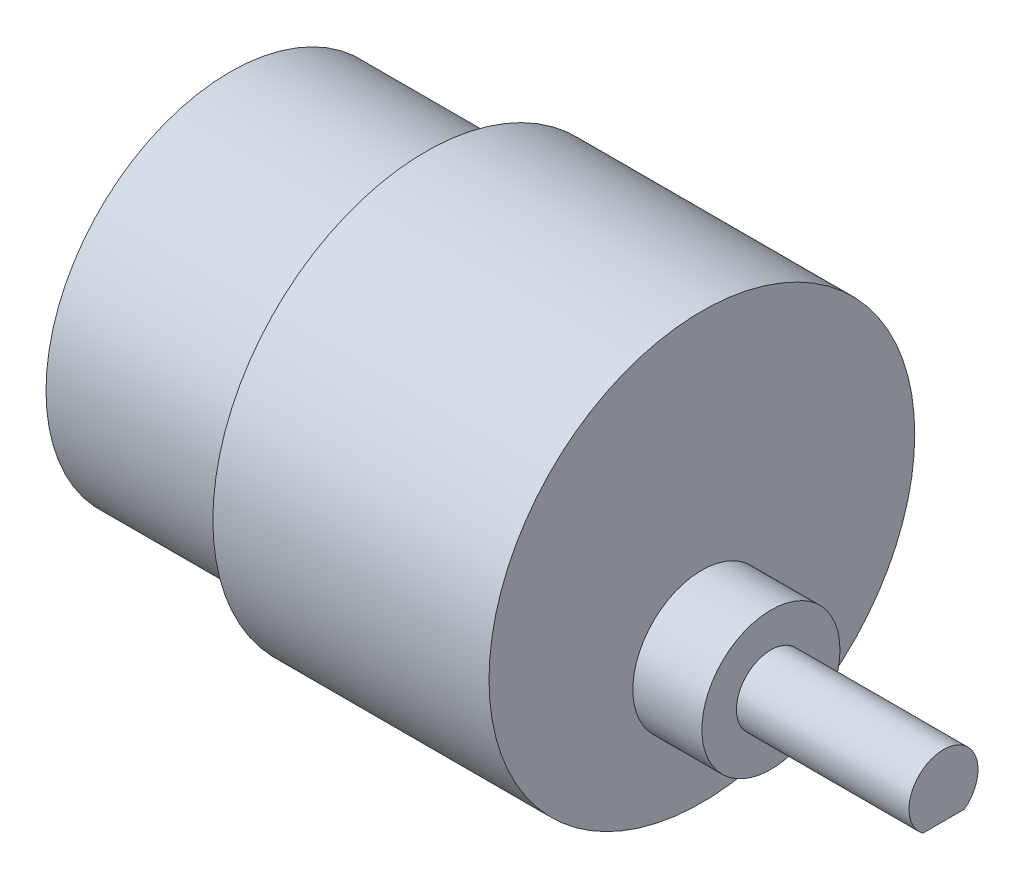
from build123d import *

# Parameters (mm, degrees)
SKETCH1_R           = 18.5
BOSS_EXTRUDE1_DEPTH = 24
SKETCH2_R           = 16
BOSS_EXTRUDE2_DEPTH = 17
SKETCH4_R           = 6
BOSS_EXTRUDE3_DEPTH = 6
SKETCH5_R           = 3
BOSS_EXTRUDE4_DEPTH = 15
SKETCH6_W           = 6.457083565
SKETCH6_H           = 2.403469994
CUT_EXTRUDE1_DEPTH  = 11
SKETCH7_R           = 3.75
BOSS_EXTRUDE5_DEPTH = 5.5


with BuildPart() as part:
    # Sketch1 → Boss-Extrude1 (new body)
    with BuildSketch(Plane(origin=(0, 0, 0), x_dir=(0, 0, -1), z_dir=(1, 0, 0))):
        Circle(SKETCH1_R)
    extrude(amount=BOSS_EXTRUDE1_DEPTH)

    # Sketch2 → Boss-Extrude2 (add)
    with BuildSketch(Plane.ZY):
        Circle(SKETCH2_R)
    extrude(amount=BOSS_EXTRUDE2_DEPTH)

    # Sketch4 → Boss-Extrude3 (add)
    with BuildSketch(Plane(origin=(24, 0, 0), x_dir=(0, 0, -1), z_dir=(1, 0, 0))):
        with Locations((0, -7)):
            Circle(SKETCH4_R)
    extrude(amount=BOSS_EXTRUDE3_DEPTH)

    # Sketch5 → Boss-Extrude4 (add)
    with BuildSketch(Plane(origin=(30, 0, 0), x_dir=(0, 0, -1), z_dir=(1, 0, 0))):
        with Locations((0, -7)):
            Circle(SKETCH5_R)
    extrude(amount=BOSS_EXTRUDE4_DEPTH)

    # Sketch6 → Cut-Extrude1 (cut)
    with BuildSketch(Plane(origin=(45, 0, 0), x_dir=(0, 0, -1), z_dir=(1, 0, 0))):
        with Locations((-0.362875994, -10.601734997)):
            Rectangle(SKETCH6_W, SKETCH6_H)
    extrude(amount=-CUT_EXTRUDE1_DEPTH, mode=Mode.SUBTRACT)

    # Sketch7 → Boss-Extrude5 (add)
    with BuildSketch(Plane.ZY.offset(17)):
        Circle(SKETCH7_R)
    extrude(amount=BOSS_EXTRUDE5_DEPTH)


solid = part.part
